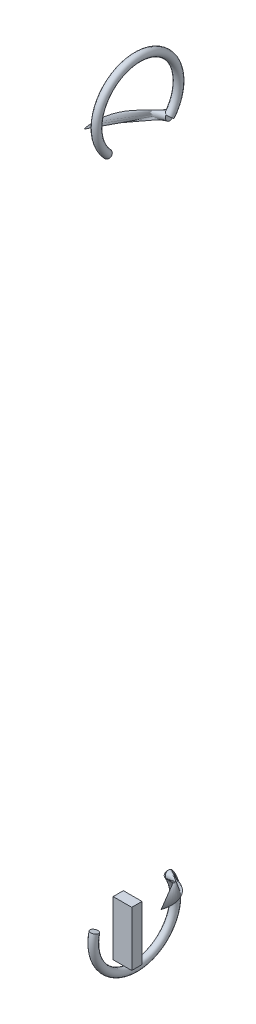
from build123d import *

# Parameters (mm, degrees)
SWEEP1_PITCH        = 2
SWEEP1_HEIGHT       = 36
SWEEP1_RADIUS       = 2.3
SWEEP1_START_ANGLE  = -180
SWEEP1_PROFILE_R    = 0.21
SWEEP2_PROFILE_R    = 0.21
SWEEP3_PROFILE_R    = 0.21
SKETCH44_W          = 1.020946181
SKETCH44_H          = 0.560801424
BOSS_EXTRUDE1_DEPTH = 3


with BuildPart() as part:
    # Sweep1: sweep along a helix
    with BuildLine() as sweep1_path:
        add(Helix(SWEEP1_PITCH, SWEEP1_HEIGHT, SWEEP1_RADIUS, center=(0, 0, 0), direction=(0, 1, 0), lefthand=True, mode=Mode.PRIVATE).rotate(Axis((0, 0, 0), (0, 1, 0)), SWEEP1_START_ANGLE))
    # Sweep1 profile (on start of the path) → Sweep1 (sweep)
    with BuildSketch(Plane(origin=(0, 0, -2.3), x_dir=(-0.13708897353742294, 0.9905587379527051, 0), z_dir=(0.9905587379527051, 0.13708897353742294, -7.165813803402872e-14))):
        Circle(SWEEP1_PROFILE_R)
    sweep(path=sweep1_path.line, is_frenet=True)

    # Sweep2: sweep along a path in Sketch28
    with BuildLine(Plane(origin=(0, 0, 0), x_dir=(0, 0, -1), z_dir=(1, 0, 0))) as sweep2_path:
        ThreePointArc((2.3, 36), (0.487991292, 39.67671385), (-1.08120807, 35.889998433))
    # Sweep2 profile (on start of the path) → Sweep2 (sweep)
    with BuildSketch(Plane(origin=(0, 36, -2.3), x_dir=(0, 0.6346238297037747, 0.7728211919791761), z_dir=(0, 0.7728211919791761, -0.6346238297037747))):
        Circle(SWEEP2_PROFILE_R)
    sweep(path=sweep2_path.line)

    # Sweep3: sweep along a path in Sketch43
    with BuildLine(Plane(origin=(0, 0, 0), x_dir=(0, 0, -1), z_dir=(1, 0, 0))) as sweep3_path:
        ThreePointArc((2.3, 0), (0.747963022, -3.407163869), (-1.800657169, -0.664515599))
    # Sweep3 profile (on start of the path) → Sweep3 (sweep)
    with BuildSketch(Plane(origin=(0, 0, -2.3), x_dir=(0, 0.5271722427709764, -0.8497584518272348), z_dir=(0, -0.8497584518272348, -0.5271722427709764))):
        Circle(SWEEP3_PROFILE_R)
    sweep(path=sweep3_path.line)


with BuildPart() as body_2:
    # Sketch44 → Boss-Extrude1 (new body)
    with BuildSketch(Plane(origin=(0, 0, 0), x_dir=(1, 0, 0), z_dir=(0, 1, 0))):
        with Locations((0.021569286, -0.005085845)):
            Rectangle(SKETCH44_W, SKETCH44_H)
    extrude(amount=-BOSS_EXTRUDE1_DEPTH)


solid = Compound([part.part, body_2.part])
